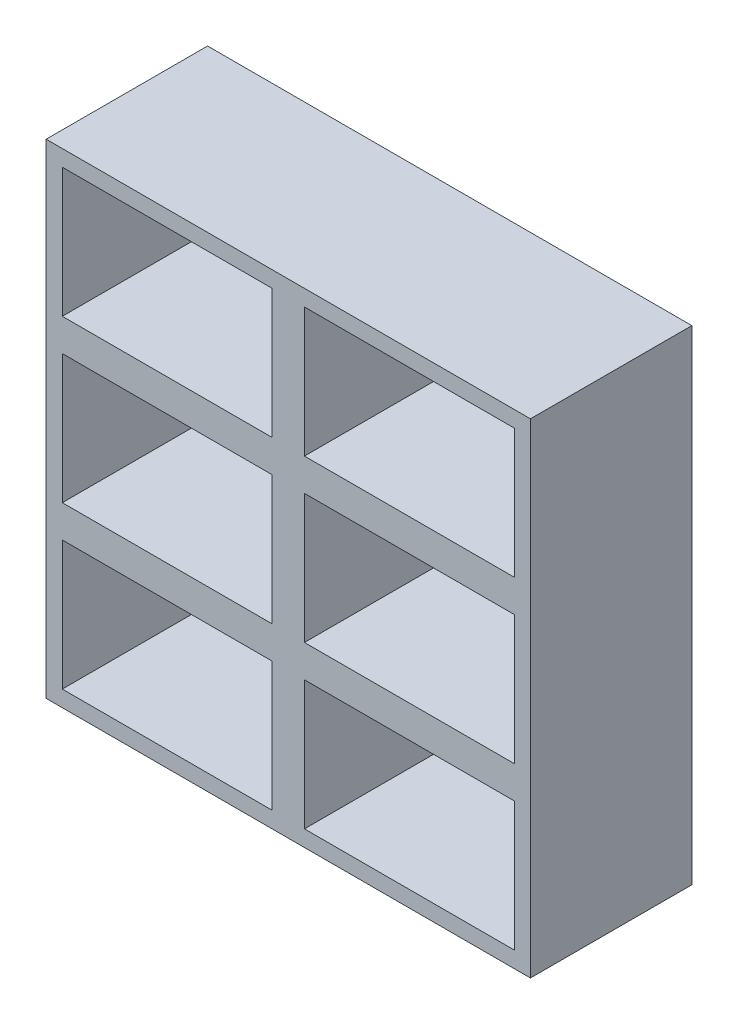
from build123d import *

# Parameters (mm, degrees)
SKETCH_1_W          = 60
SKETCH_1_H          = 60
EXTRUDE_1_DEPTH     = 20
SKETCH_2_W          = 26
SKETCH_2_H          = 16
CUT_EXTRUDE_1_DEPTH = 18


with BuildPart() as part:
    # 草图1 → 凸台-拉伸1 (new body)
    with BuildSketch(Plane.XY):
        with Locations((30, 30)):
            Rectangle(SKETCH_1_W, SKETCH_1_H)
    extrude(amount=-EXTRUDE_1_DEPTH)

    # 草图2 → 切除-拉伸1 (cut)
    with BuildSketch(Plane.XY):
        with Locations((15, 50)):
            Rectangle(SKETCH_2_W, SKETCH_2_H)
        with Locations((45, 50)):
            Rectangle(SKETCH_2_W, SKETCH_2_H)
        with Locations((15, 30)):
            Rectangle(SKETCH_2_W, SKETCH_2_H)
        with Locations((45, 30)):
            Rectangle(SKETCH_2_W, SKETCH_2_H)
        with Locations((15, 10)):
            Rectangle(SKETCH_2_W, SKETCH_2_H)
        with Locations((45, 10)):
            Rectangle(SKETCH_2_W, SKETCH_2_H)
    extrude(amount=-CUT_EXTRUDE_1_DEPTH, mode=Mode.SUBTRACT)


solid = part.part
